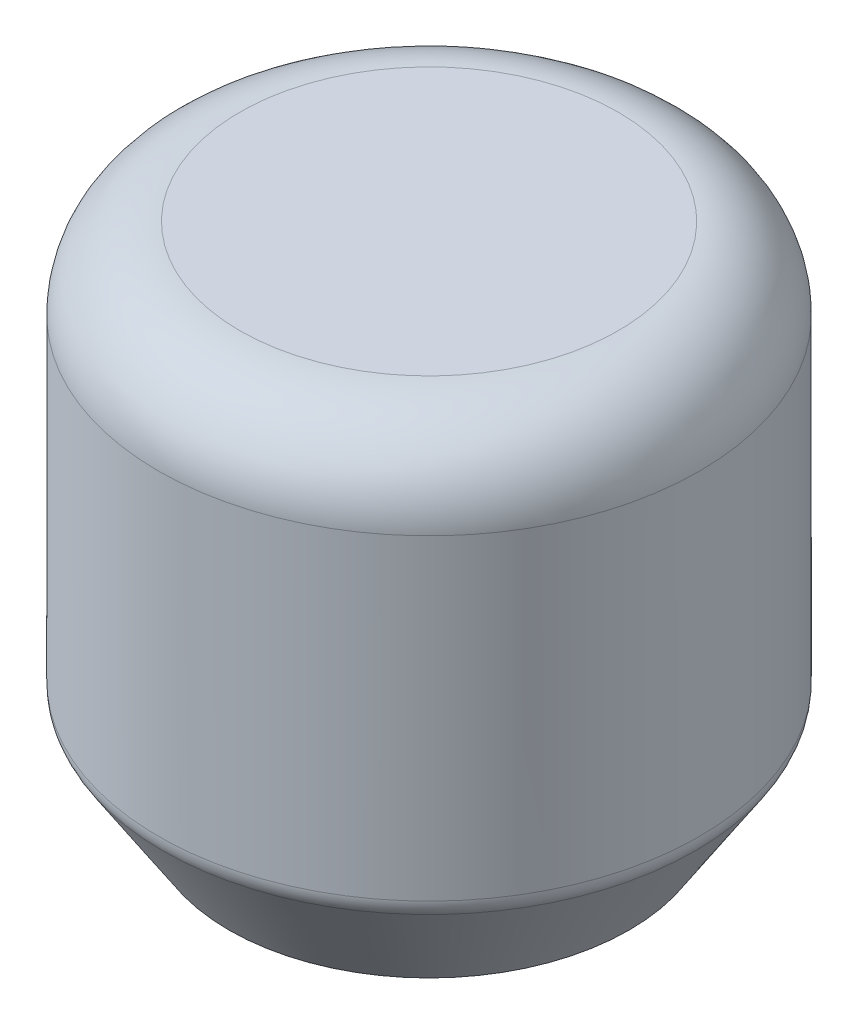
from build123d import *

# Parameters (mm, degrees)
SKETCH1_R           = 127
BOSS_EXTRUDE1_DEPTH = 241.3
FILLET1_R           = 38.1
CHAMFER1_SIZE       = 33.02
CHAMFER1_SIZE2      = 50.846341105
FILLET2_R           = 12.7


with BuildPart() as part:
    # Sketch1 → Boss-Extrude1 (new body)
    with BuildSketch(Plane(origin=(0, 0, 0), x_dir=(1, 0, 0), z_dir=(0, 1, 0))):
        with Locations(Location((0, 0, 0), (0, 0, 90))):
            Circle(SKETCH1_R)
    extrude(amount=BOSS_EXTRUDE1_DEPTH)

    # Fillet1
    fillet1_edges = [part.edges().sort_by_distance(p)[0] for p in [
        (0, 241.3, 127),
    ]]
    fillet(fillet1_edges, radius=FILLET1_R)

    # Chamfer1
    chamfer1_edges = [part.edges().sort_by_distance(p)[0] for p in [
        (0, 0, 127),
    ]]
    chamfer1_side = [part.faces().sort_by_distance(p)[0] for p in [
        (0, 0, 0),
    ]]
    chamfer(chamfer1_edges, length=CHAMFER1_SIZE, length2=CHAMFER1_SIZE2, reference=chamfer1_side[0])

    # Fillet2
    fillet2_edges = [part.edges().sort_by_distance(p)[0] for p in [
        (0, 50.846341105, 127),
    ]]
    fillet(fillet2_edges, radius=FILLET2_R)


solid = part.part
